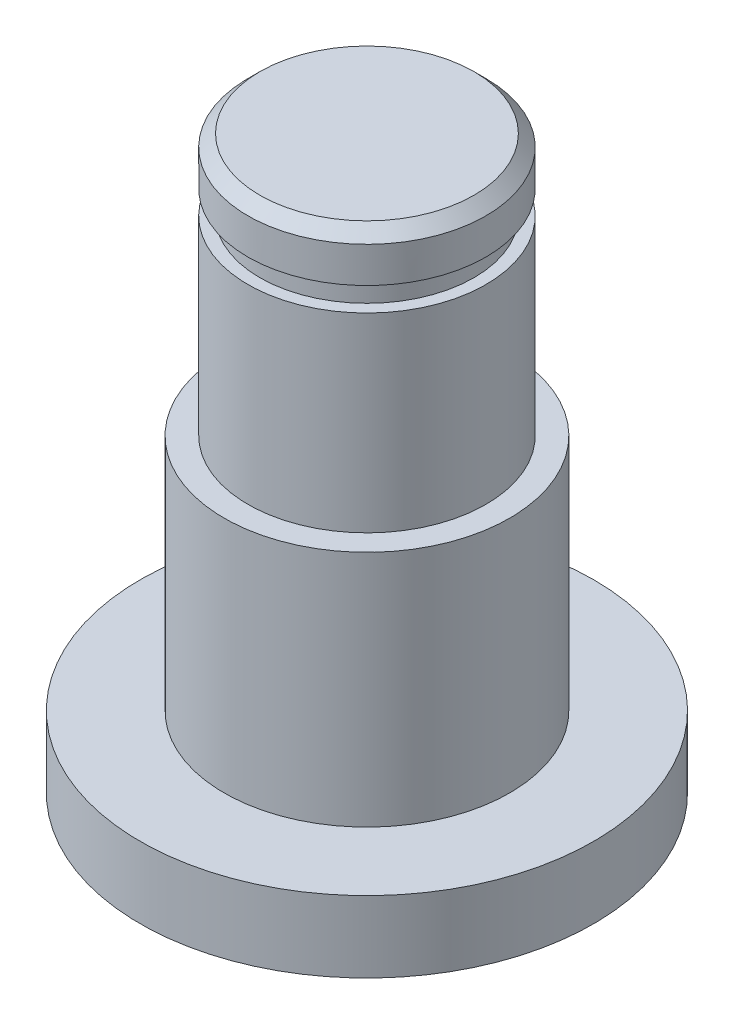
from build123d import *

# Parameters (mm, degrees)
CROQUIS2_W    = 1
CROQUIS2_H    = 1
CHAFL_N1_SIZE = 0.5


with BuildPart() as part:
    # Croquis1 → Revolución1 (revolve)
    with BuildSketch(Plane.XY, mode=Mode.PRIVATE) as revoluci_n1_sk:
        Polygon((0, 0), (-9.525, 0), (-9.525, 3), (-6, 3), (-6, 13), (-5, 13), (-5, 24), (0, 24), align=None)
    revolve(revoluci_n1_sk.sketch.rotate(Axis((0, 0, 0), (0, 1, 0)), 270), axis=Axis((0, 0, 0), (0, 1, 0)))

    # Croquis2 → Cortar-Revolución1 (revolve, cut)
    with BuildSketch(Plane.XY, mode=Mode.PRIVATE) as cortar_revoluci_n1_sk:
        with Locations((5, 21.5)):
            Rectangle(CROQUIS2_W, CROQUIS2_H)
    revolve(cortar_revoluci_n1_sk.sketch.rotate(Axis((0, 0, 0), (0, 1, 0)), 90), axis=Axis((0, 0, 0), (0, 1, 0)), mode=Mode.SUBTRACT)

    # Chaflán1
    chafl_n1_edges = [part.edges().sort_by_distance(p)[0] for p in [
        (0, 24, 5),
    ]]
    chamfer(chafl_n1_edges, length=CHAFL_N1_SIZE)


solid = part.part
